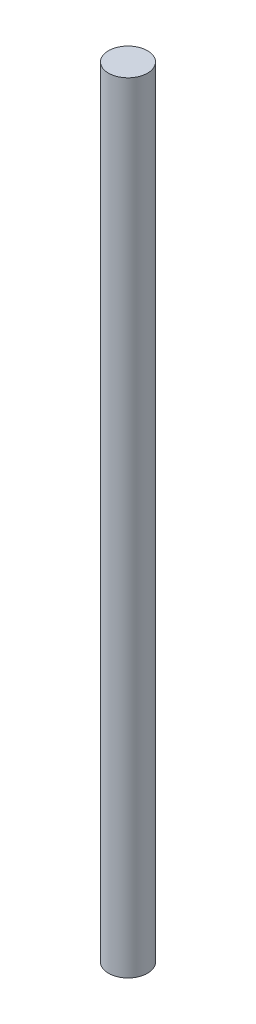
from build123d import *

# Parameters (mm, degrees)
SKETCH1_R           = 2.5
BOSS_EXTRUDE1_DEPTH = 100


with BuildPart() as part:
    # Sketch1 → Boss-Extrude1 (new body)
    with BuildSketch(Plane(origin=(0, 0, 0), x_dir=(1, 0, 0), z_dir=(0, 1, 0))):
        with Locations(Location((0, 0, 0), (0, 0, 270))):
            Circle(SKETCH1_R)
    extrude(amount=BOSS_EXTRUDE1_DEPTH)


solid = part.part
